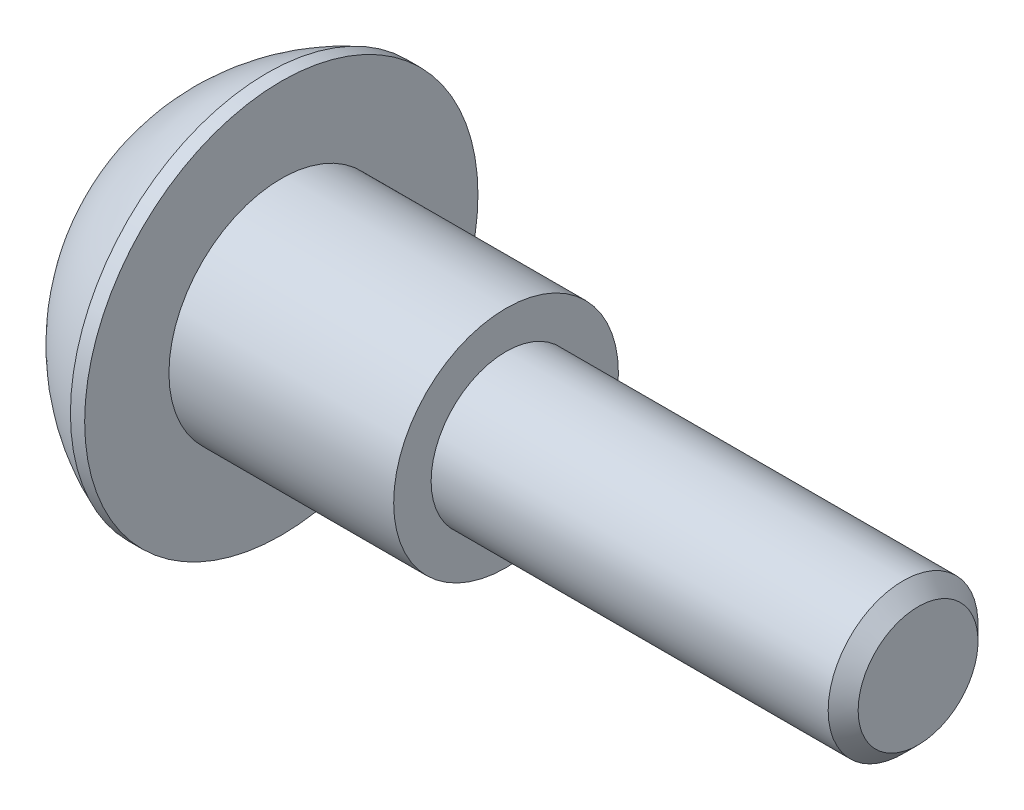
from build123d import *

# Parameters (mm, degrees)
FILLET1_R                = 0.01
HEX_2_DEPTH              = 2.08
ESBO_O1_R                = 3
RESSALTO_EXTRUS_O1_DEPTH = 6


with BuildPart() as part:
    # BodySke → BaseBody (revolve)
    with BuildSketch(Plane.XY, mode=Mode.PRIVATE) as basebody_sk:
        with BuildLine():
            Line((20.3, 0), (20.3, 1.6))
            Line((20.3, 1.6), (19.9, 2))
            Line((19.9, 2), (3.3, 2))
            Line((3.3, 2), (3.3, 5.25))
            Line((3.3, 5.25), (2.92, 5.25))
            ThreePointArc((2.92, 5.25), (1.224500646, 4.199464996), (0, 2.625))
            Line((0, 2.625), (0, 0))
            Line((0, 0), (20.3, 0))
        make_face()
    revolve(basebody_sk.sketch.rotate(Axis((0, 0, 0), (1, 0, 0)), 90), axis=Axis((0, 0, 0), (1, 0, 0)))

    # Fillet1
    fillet1_edges = [part.edges().sort_by_distance(p)[0] for p in [
        (3.3, 0, -2),
    ]]
    fillet(fillet1_edges, radius=FILLET1_R)

    # Sketch2 → PreBroach (revolve, cut)
    with BuildSketch(Plane.XY, mode=Mode.PRIVATE) as prebroach_sk:
        Polygon((0, 2), (2.08, 2), (3.234700538, 0), (0, 0), align=None)
    revolve(prebroach_sk.sketch.rotate(Axis((0, 0, 0), (1, 0, 0)), 90), axis=Axis((0, 0, 0), (1, 0, 0)), mode=Mode.SUBTRACT)

    # Sketch3 → Hex 2 (cut)
    with BuildSketch(Plane(origin=(0, 0, 0), x_dir=(0, 0, -1), z_dir=(1, 0, 0))):
        Polygon((-2, -1.154700538), (-2, 1.154700538), (0, 2.309401077), (2, 1.154700538), (2, -1.154700538), (0, -2.309401077), align=None)
    extrude(amount=HEX_2_DEPTH, mode=Mode.SUBTRACT)

    # Esboço1 → Ressalto-extrusão1 (add)
    with BuildSketch(Plane(origin=(3.3, 0, 0), x_dir=(0, 0, -1), z_dir=(1, 0, 0))):
        with Locations(Location((0, 0, 0), (0, 0, 180))):
            Circle(ESBO_O1_R)
    extrude(amount=RESSALTO_EXTRUS_O1_DEPTH)


solid = part.part
